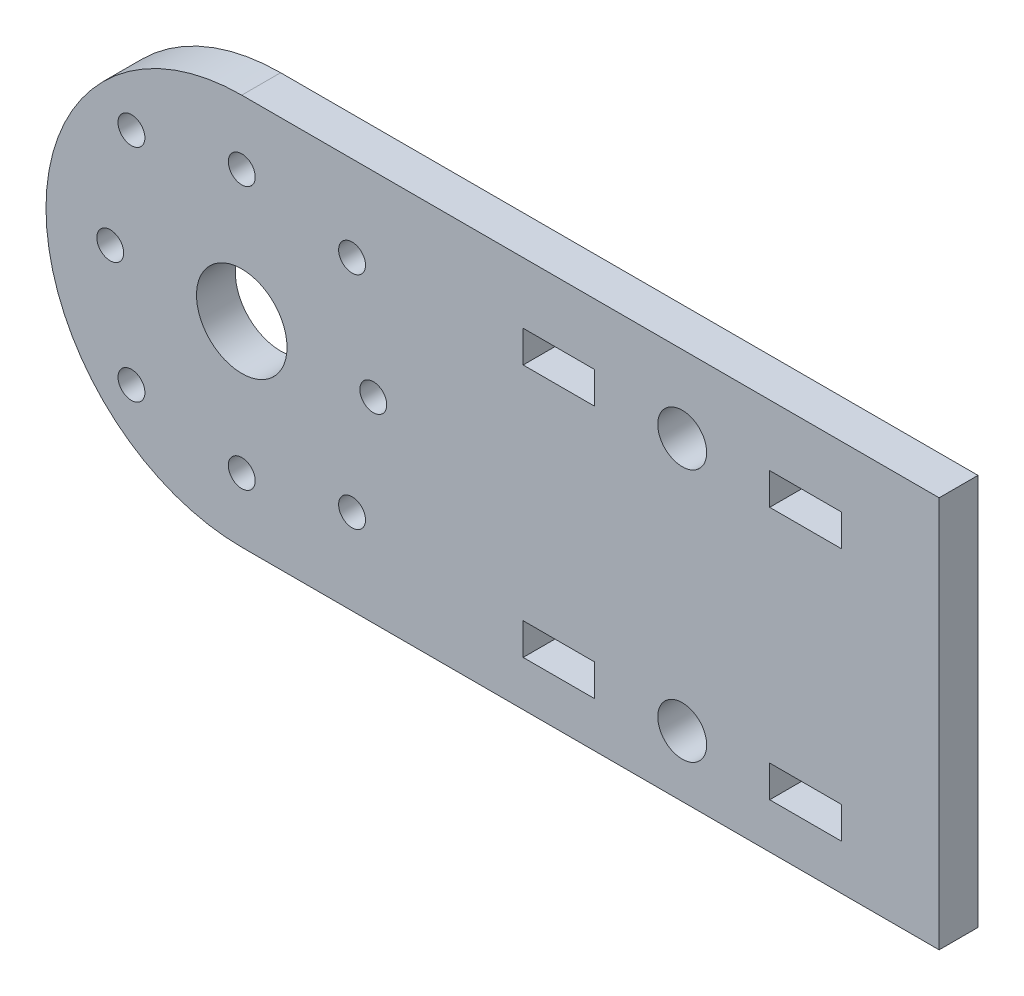
from build123d import *

# Parameters (mm, degrees)
SKETCH1_R           = 1.1
SKETCH1_R_2         = 3.7
SKETCH1_R_3         = 2
SKETCH1_W           = 5.85
SKETCH1_H           = 2.6
BOSS_EXTRUDE1_DEPTH = 3.175


with BuildPart() as part:
    # Sketch1 → Boss-Extrude1 (new body)
    with BuildSketch(Plane.XY):
        with BuildLine():
            Line((19, 0), (76, 0))
            Line((76, 0), (76, 32))
            Line((76, 32), (19, 32))
            ThreePointArc((19, 32), (3, 16), (19, 0))
        make_face()
        with Locations((8.25, 16)):
            Circle(SKETCH1_R, mode=Mode.SUBTRACT)
        with Locations((9.98438854, 25.01561146)):
            Circle(SKETCH1_R, mode=Mode.SUBTRACT)
        with Locations((28.01561146, 25.01561146)):
            Circle(SKETCH1_R, mode=Mode.SUBTRACT)
        with Locations((28.01561146, 6.98438854)):
            Circle(SKETCH1_R, mode=Mode.SUBTRACT)
        with Locations((9.98438854, 6.98438854)):
            Circle(SKETCH1_R, mode=Mode.SUBTRACT)
        with Locations((19, 26.75)):
            Circle(SKETCH1_R, mode=Mode.SUBTRACT)
        with Locations((29.75, 16)):
            Circle(SKETCH1_R, mode=Mode.SUBTRACT)
        with Locations((19, 5.25)):
            Circle(SKETCH1_R, mode=Mode.SUBTRACT)
        with Locations((19, 16)):
            Circle(SKETCH1_R_2, mode=Mode.SUBTRACT)
        with Locations((55, 5)):
            Circle(SKETCH1_R_3, mode=Mode.SUBTRACT)
        with Locations((55, 25.7)):
            Circle(SKETCH1_R_3, mode=Mode.SUBTRACT)
        with Locations((44.925, 25.7)):
            Rectangle(SKETCH1_W, SKETCH1_H, mode=Mode.SUBTRACT)
        with Locations((65.075, 25.7)):
            Rectangle(SKETCH1_W, SKETCH1_H, mode=Mode.SUBTRACT)
        with Locations((44.925, 5)):
            Rectangle(SKETCH1_W, SKETCH1_H, mode=Mode.SUBTRACT)
        with Locations((65.075, 5)):
            Rectangle(SKETCH1_W, SKETCH1_H, mode=Mode.SUBTRACT)
    extrude(amount=BOSS_EXTRUDE1_DEPTH)


solid = part.part
